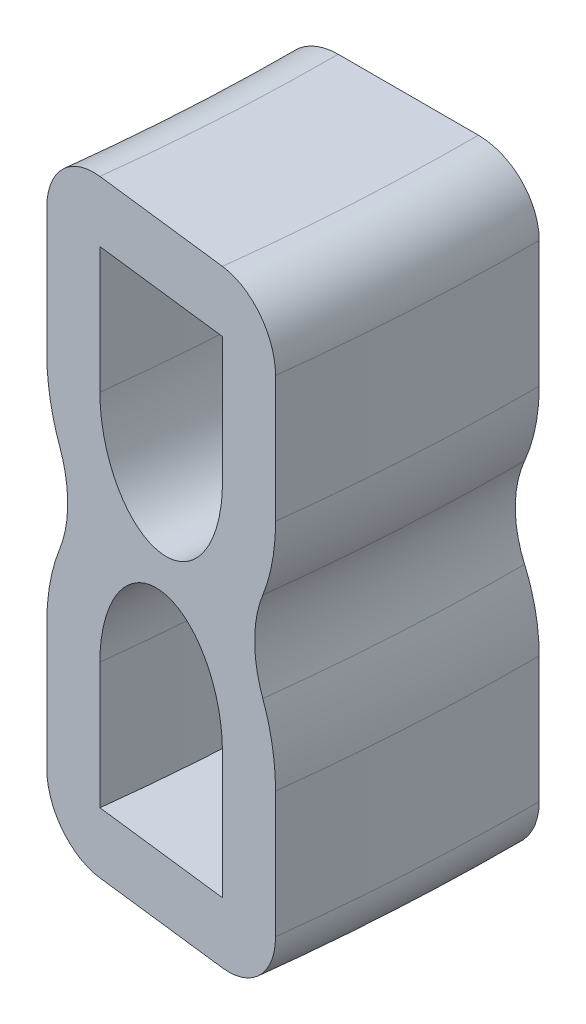
from build123d import *


with BuildPart() as part:
    # Sweep2: sweep along a path in Sketch12
    with BuildLine(Plane(origin=(0, 0, 0), x_dir=(1, 0, 0), z_dir=(0, 1, 0))) as sweep2_path:
        ThreePointArc((0, 0), (-0.074470784, -2.5), (-0.297619048, -4.99113443))
    # Sketch2 → Sweep2 (sweep)
    with BuildSketch(Plane.XY):
        with BuildLine():
            Line((-1.5, -2.8), (1.5, -2.8))
            ThreePointArc((1.5, -2.8), (2.419238816, -2.419238816), (2.8, -1.5))
            Line((2.8, -1.5), (2.8, 1.2))
            add(Edge.make_bspline(
                [(2.8, 1.2), (2.8, 2.022141475), (2.487772802, 2.74054726)],
                knots=[1.570796327, 1.570796327, 1.570796327, 2.078583583, 2.078583583, 2.078583583], degree=2, weights=[1, 0.967941781, 1]))
            ThreePointArc((2.487772802, 2.74054726), (2.288291027, 3.7), (2.487772802, 4.65945274))
            add(Edge.make_bspline(
                [(2.487772802, 4.65945274), (2.8, 5.377858525), (2.8, 6.2)],
                knots=[1.06300907, 1.06300907, 1.06300907, 1.570796327, 1.570796327, 1.570796327], degree=2, weights=[1, 0.967941781, 1]))
            Line((2.8, 6.2), (2.8, 8.9))
            ThreePointArc((2.8, 8.9), (2.419238816, 9.819238816), (1.5, 10.2))
            Line((1.5, 10.2), (-1.5, 10.2))
            ThreePointArc((-1.5, 10.2), (-2.419238816, 9.819238816), (-2.8, 8.9))
            Line((-2.8, 8.9), (-2.8, 6.2))
            add(Edge.make_bspline(
                [(-2.8, 6.2), (-2.8, 5.377858525), (-2.487772802, 4.65945274)],
                knots=[4.71238898, 4.71238898, 4.71238898, 5.220176237, 5.220176237, 5.220176237], degree=2, weights=[1, 0.967941781, 1]))
            ThreePointArc((-2.487772802, 4.65945274), (-2.288291027, 3.7), (-2.487772802, 2.74054726))
            add(Edge.make_bspline(
                [(-2.487772802, 2.74054726), (-2.8, 2.022141475), (-2.8, 1.2)],
                knots=[4.204601724, 4.204601724, 4.204601724, 4.71238898, 4.71238898, 4.71238898], degree=2, weights=[1, 0.967941781, 1]))
            Line((-2.8, 1.2), (-2.8, -1.5))
            ThreePointArc((-2.8, -1.5), (-2.419238816, -2.419238816), (-1.5, -2.8))
        make_face()
        with BuildLine():
            Line((-1.5, -1.5), (1.5, -1.5))
            Line((1.5, -1.5), (1.5, 1.2))
            add(Edge.make_bspline(
                [(1.5, 1.2), (1.5, 3.35), (0, 3.35), (-1.5, 3.35), (-1.5, 1.2)],
                knots=[4.71238898, 4.71238898, 4.71238898, 6.283185307, 6.283185307, 7.853981634, 7.853981634, 7.853981634], degree=2, weights=[1, 0.707106781, 1, 0.707106781, 1]))
            Line((-1.5, 1.2), (-1.5, -1.5))
        make_face(mode=Mode.SUBTRACT)
        with BuildLine():
            Line((1.5, 8.9), (1.5, 6.2))
            add(Edge.make_bspline(
                [(-1.5, 6.2), (-1.5, 4.05), (0, 4.05), (1.5, 4.05), (1.5, 6.2)],
                knots=[4.71238898, 4.71238898, 4.71238898, 6.283185307, 6.283185307, 7.853981634, 7.853981634, 7.853981634], degree=2, weights=[1, 0.707106781, 1, 0.707106781, 1]))
            Line((-1.5, 6.2), (-1.5, 8.9))
            Line((-1.5, 8.9), (1.5, 8.9))
        make_face(mode=Mode.SUBTRACT)
    sweep(path=sweep2_path.line)


solid = part.part
